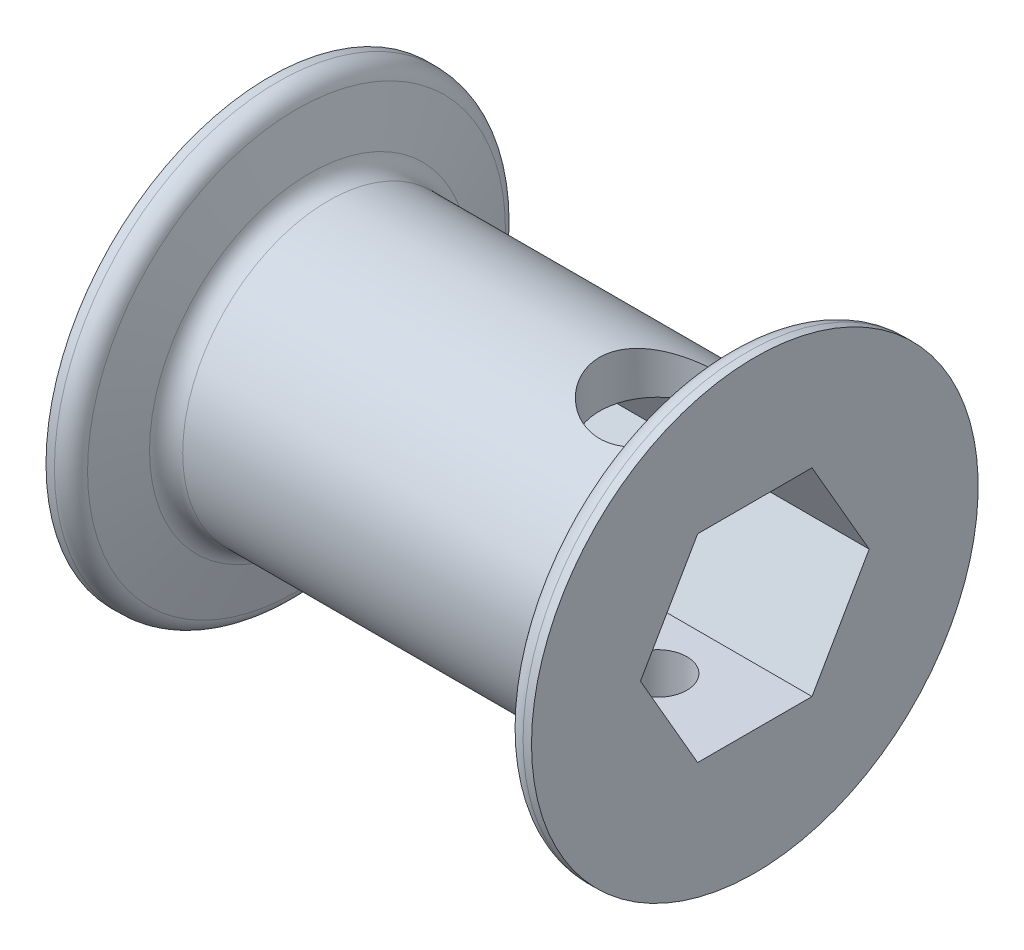
from build123d import *

# Parameters (mm, degrees)
CUT_EXTRUDE1_DEPTH = 38.877097962
FILLET1_R          = 1.27


with BuildPart() as part:
    # Sketch1 → Revolve1 (revolve)
    with BuildSketch(Plane.XY, mode=Mode.PRIVATE) as revolve1_sk:
        Polygon((0, 0), (31.75, 0), (31.75, 14.605), (30.226, 14.605), (28.864818102, 9.525), (2.885181898, 9.525), (1.524, 14.605), (0, 14.605), align=None)
    revolve(revolve1_sk.sketch.rotate(Axis((31.75, 0, 0), (1, 0, 0)), 90), axis=Axis((31.75, 0, 0), (1, 0, 0)))

    # Sketch2 → Cut-Extrude1 (cut, through all)
    with BuildSketch(Plane.ZY):
        Polygon((7.478995387, 0), (3.739497694, 6.477), (-3.739497694, 6.477), (-7.478995387, 0), (-3.739497694, -6.477), (3.739497694, -6.477), align=None)
    extrude(amount=-CUT_EXTRUDE1_DEPTH, mode=Mode.SUBTRACT)

    # Fillet1
    fillet1_edges = [part.edges().sort_by_distance(p)[0] for p in [
        (1.524, 0, -14.605),
        (2.885181898, 0, -9.525),
        (28.864818102, 0, -9.525),
        (30.226, 0, -14.605),
    ]]
    fillet(fillet1_edges, radius=FILLET1_R)

    # Sketch3 → Cut-Revolve1 (revolve, cut)
    with BuildSketch(Plane.XY, mode=Mode.PRIVATE) as cut_revolve1_sk:
        Polygon((27.305, -14.605), (25.4, -14.605), (25.4, 14.605), (29.21, 14.605), (29.21, -0.025313637), (27.305, -0.025313637), align=None)
    revolve(cut_revolve1_sk.sketch.rotate(Axis((25.4, 14.605, 0), (0, 1, 0)), 101.039484404), axis=Axis((25.4, 14.605, 0), (0, 1, 0)), mode=Mode.SUBTRACT)


solid = part.part
